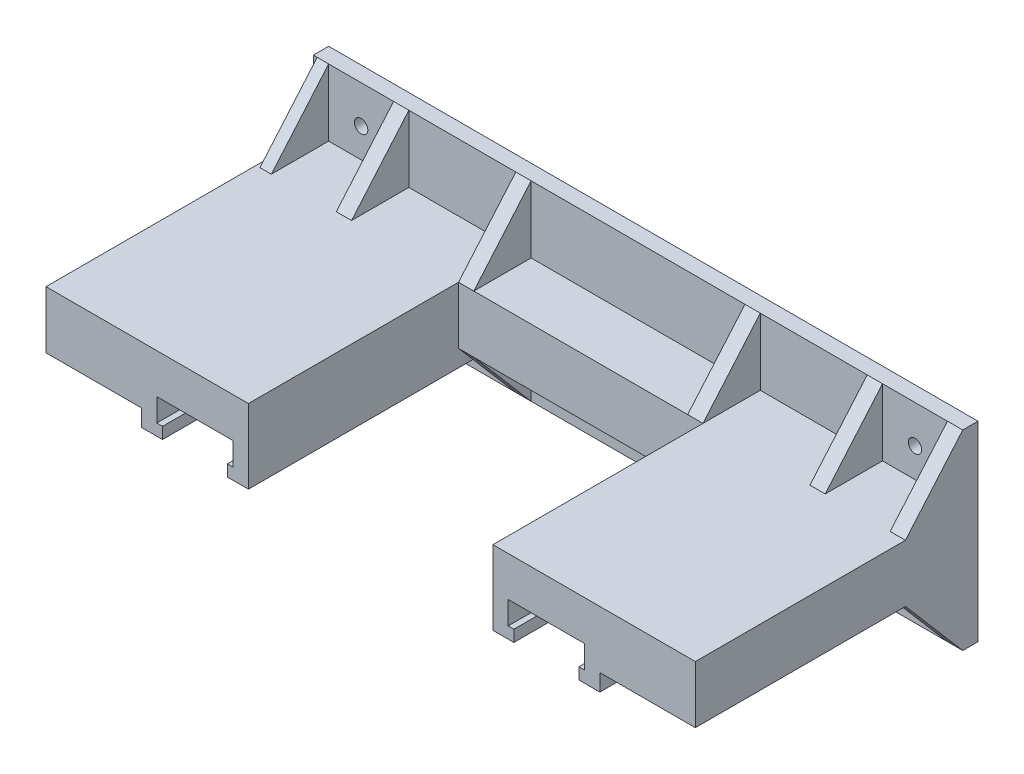
from build123d import *

# Parameters (mm, degrees)
CROQUIS1_W              = 170
CROQUIS1_H              = 50
SALIENTE_EXTRUIR1_DEPTH = 4
SALIENTE_EXTRUIR2_DEPTH = 70
SALIENTE_EXTRUIR3_DEPTH = 25
SALIENTE_EXTRUIR4_DEPTH = 64
SALIENTE_EXTRUIR5_DEPTH = 25
CROQUIS9_W              = 17
CROQUIS9_H              = 17.5
CROQUIS9_W_2            = 56
CORTAR_EXTRUIR1_DEPTH   = 70
CROQUIS11_W             = 64
CROQUIS11_H             = 55
CORTAR_EXTRUIR4_DEPTH   = 15
CROQUIS12_R             = 1.75
CORTAR_EXTRUIR5_DEPTH   = 15
CORTAR_EXTRUIR6_DEPTH   = 1


with BuildPart() as part:
    # Croquis1 → Saliente-Extruir1 (new body)
    with BuildSketch(Plane.XY):
        Rectangle(CROQUIS1_W, CROQUIS1_H)
    extrude(amount=SALIENTE_EXTRUIR1_DEPTH)

    # Croquis3 → Saliente-Extruir2 (add)
    with BuildSketch(Plane.XY.offset(4)):
        Polygon((-85, 7.5), (85, 7.5), (85, -7.5), (60, -7.5), (60, -11.921199344), (56, -11.921199344), (54.5, -11.921199344), (54.5, -8.921199344), (56, -8.921199344), (56, -2.921199344), (36, -2.921199344), (36, -8.921199344), (37.5, -8.921199344), (37.5, -11.921199344), (36, -11.921199344), (32, -11.921199344), (32, -7.5), (-32, -7.5), (-32, -11.921199344), (-36, -11.921199344), (-37.5, -11.921199344), (-37.5, -8.921199344), (-36, -8.921199344), (-36, -2.921199344), (-56, -2.921199344), (-56, -8.921199344), (-54.5, -8.921199344), (-54.5, -11.921199344), (-56, -11.921199344), (-60, -11.921199344), (-60, -7.5), (-85, -7.5), align=None)
    extrude(amount=SALIENTE_EXTRUIR2_DEPTH)

    # Croquis4 → Saliente-Extruir3 (add)
    with BuildSketch(Plane.ZY.offset(85)):
        Polygon((4, -25), (19, -7.5), (4, -7.5), align=None)
    saliente_extruir3 = extrude(amount=-SALIENTE_EXTRUIR3_DEPTH)

    # Croquis5 → Saliente-Extruir4 (add)
    with BuildSketch(Plane.ZY.offset(-32)):
        Polygon((19, -7.5), (4, -25), (4, -7.5), align=None)
    saliente_extruir4 = extrude(amount=SALIENTE_EXTRUIR4_DEPTH)

    # Croquis7 → Saliente-Extruir5 (add)
    with BuildSketch(Plane(origin=(60, 0, 0), x_dir=(0, 0, -1), z_dir=(1, 0, 0))):
        Polygon((-4, -25), (-19, -7.5), (-4, -7.5), align=None)
    saliente_extruir5 = extrude(amount=SALIENTE_EXTRUIR5_DEPTH)

    # Croquis9 → Cortar-Extruir1 (cut)
    with BuildSketch(Plane.XY.offset(74)):
        with Locations((-72.5, -16.25)):
            Rectangle(CROQUIS9_W, CROQUIS9_H)
        with Locations((0, -16.25)):
            Rectangle(CROQUIS9_W_2, CROQUIS9_H)
        with Locations((72.5, -16.25)):
            Rectangle(CROQUIS9_W, CROQUIS9_H)
    cortar_extruir1 = extrude(amount=-CORTAR_EXTRUIR1_DEPTH, mode=Mode.SUBTRACT)

    # Croquis11 → Cortar-Extruir4 (cut)
    with BuildSketch(Plane.XZ.offset(7.5)):
        with Locations((0, 46.5)):
            Rectangle(CROQUIS11_W, CROQUIS11_H)
    extrude(amount=-CORTAR_EXTRUIR4_DEPTH, mode=Mode.SUBTRACT)

    # Croquis12 → Cortar-Extruir5 (cut)
    with BuildSketch(Plane.XY.offset(4)):
        with Locations((-72.5, 15.138462845)):
            Circle(CROQUIS12_R)
        with Locations((-72.5, -15.138462845)):
            Circle(CROQUIS12_R)
        with Locations((72.5, -15.138462845)):
            Circle(CROQUIS12_R)
        with Locations((72.5, 15.138462845)):
            Circle(CROQUIS12_R)
    extrude(amount=-CORTAR_EXTRUIR5_DEPTH, mode=Mode.SUBTRACT)

    # Croquis14 → Cortar-Extruir6 (cut)
    with BuildSketch(Plane.ZY.offset(85)):
        Polygon((19, -7.5), (4, -7.5), (4, -25), align=None)
    cortar_extruir6 = extrude(amount=-CORTAR_EXTRUIR6_DEPTH, mode=Mode.SUBTRACT)

    # Simetría1: Saliente-Extruir3, Saliente-Extruir4, Saliente-Extruir5, Cortar-Extruir1, Cortar-Extruir6 across plane
    add(saliente_extruir3.mirror(Plane(origin=(0, 0, 0), x_dir=(0, 0, 1), z_dir=(0, -1, 0))))
    add(saliente_extruir4.mirror(Plane(origin=(0, 0, 0), x_dir=(0, 0, 1), z_dir=(0, -1, 0))))
    add(saliente_extruir5.mirror(Plane(origin=(0, 0, 0), x_dir=(0, 0, 1), z_dir=(0, -1, 0))))
    add(cortar_extruir1.mirror(Plane(origin=(0, 0, 0), x_dir=(0, 0, 1), z_dir=(0, -1, 0))), mode=Mode.SUBTRACT)
    add(cortar_extruir6.mirror(Plane(origin=(0, 0, 0), x_dir=(0, 0, 1), z_dir=(0, -1, 0))), mode=Mode.SUBTRACT)


solid = part.part
